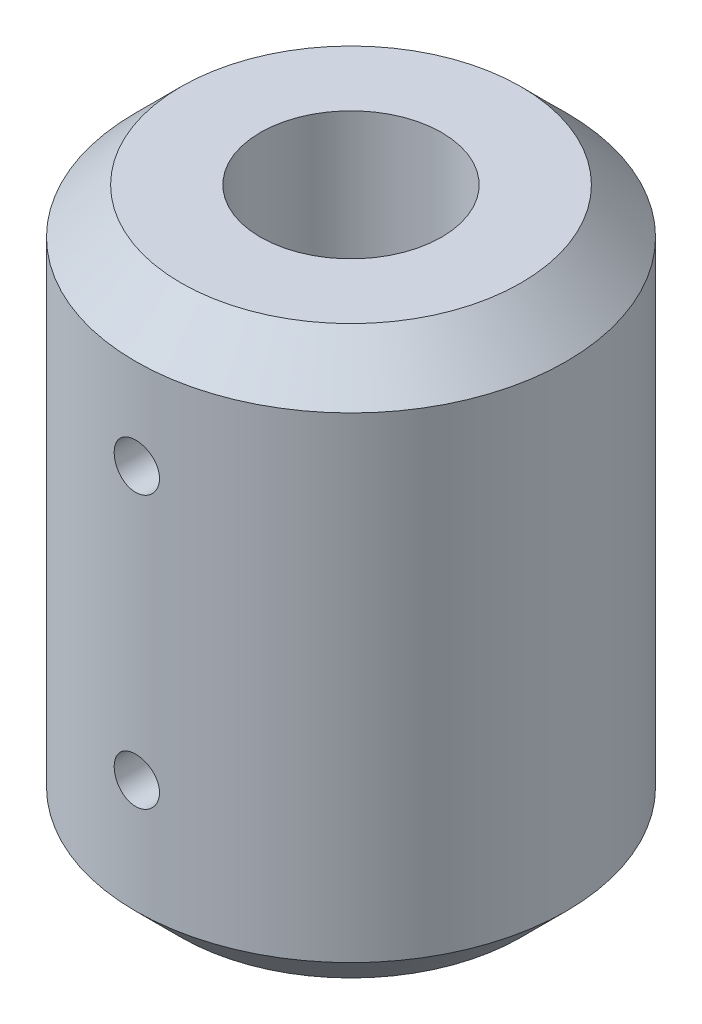
from build123d import *

# Parameters (mm, degrees)
SKETCH1_R           = 9.5
BOSS_EXTRUDE1_DEPTH = 25
SKETCH2_R           = 2.5
CUT_EXTRUDE1_DEPTH  = 15
SKETCH3_R           = 4
CUT_EXTRUDE2_DEPTH  = 20.767397401
CHAMFER1_SIZE       = 2
CUT_EXTRUDE3_REACH  = 34.806
SKETCH13_R          = 1


with BuildPart() as part:
    # Sketch1 → Boss-Extrude1 (new body)
    with BuildSketch(Plane(origin=(0, 0, 0), x_dir=(1, 0, 0), z_dir=(0, 1, 0))):
        with Locations(Location((0, 0, 0), (0, 0, 270))):
            Circle(SKETCH1_R)
    extrude(amount=BOSS_EXTRUDE1_DEPTH)

    # Sketch2 → Cut-Extrude1 (cut)
    with BuildSketch(Plane(origin=(0, 0, 0), x_dir=(1, 0, 0), z_dir=(0, 1, 0))):
        with Locations(Location((0, 0, 0), (0, 0, 270))):
            Circle(SKETCH2_R)
    extrude(amount=CUT_EXTRUDE1_DEPTH, mode=Mode.SUBTRACT)

    # Sketch3 → Cut-Extrude2 (cut, through all)
    with BuildSketch(Plane(origin=(0, 14.5, 0), x_dir=(1, 0, 0), z_dir=(0, 1, 0))):
        with Locations(Location((0, 0, 0), (0, 0, 90))):
            Circle(SKETCH3_R)
    extrude(amount=CUT_EXTRUDE2_DEPTH, mode=Mode.SUBTRACT)

    # Chamfer1
    chamfer1_edges = [part.edges().sort_by_distance(p)[0] for p in [
        (0, 0, -9.5),
        (0, 25, -9.5),
    ]]
    chamfer(chamfer1_edges, length=CHAMFER1_SIZE)

    # Sketch13 → Cut-Extrude3 (cut, up to next)
    with BuildSketch(Plane.XY.offset(9.5), mode=Mode.PRIVATE) as cut_extrude3_sk1:
        with Locations((0, 19)):
            Circle(SKETCH13_R)
    cut_extrude3_tool1 = extrude(cut_extrude3_sk1.sketch, amount=-CUT_EXTRUDE3_REACH, mode=Mode.PRIVATE) & part.part
    # Sketch13 → Cut-Extrude3 (cut, up to next)
    with BuildSketch(Plane.XY.offset(9.5), mode=Mode.PRIVATE) as cut_extrude3_sk2:
        with Locations((0, 7)):
            Circle(SKETCH13_R)
    cut_extrude3_tool2 = extrude(cut_extrude3_sk2.sketch, amount=-CUT_EXTRUDE3_REACH, mode=Mode.PRIVATE) & part.part
    add(cut_extrude3_tool1.solids().sort_by_distance((0, 19, 9.5))[0], mode=Mode.SUBTRACT)
    add(cut_extrude3_tool2.solids().sort_by_distance((0, 7, 9.5))[0], mode=Mode.SUBTRACT)


solid = part.part
